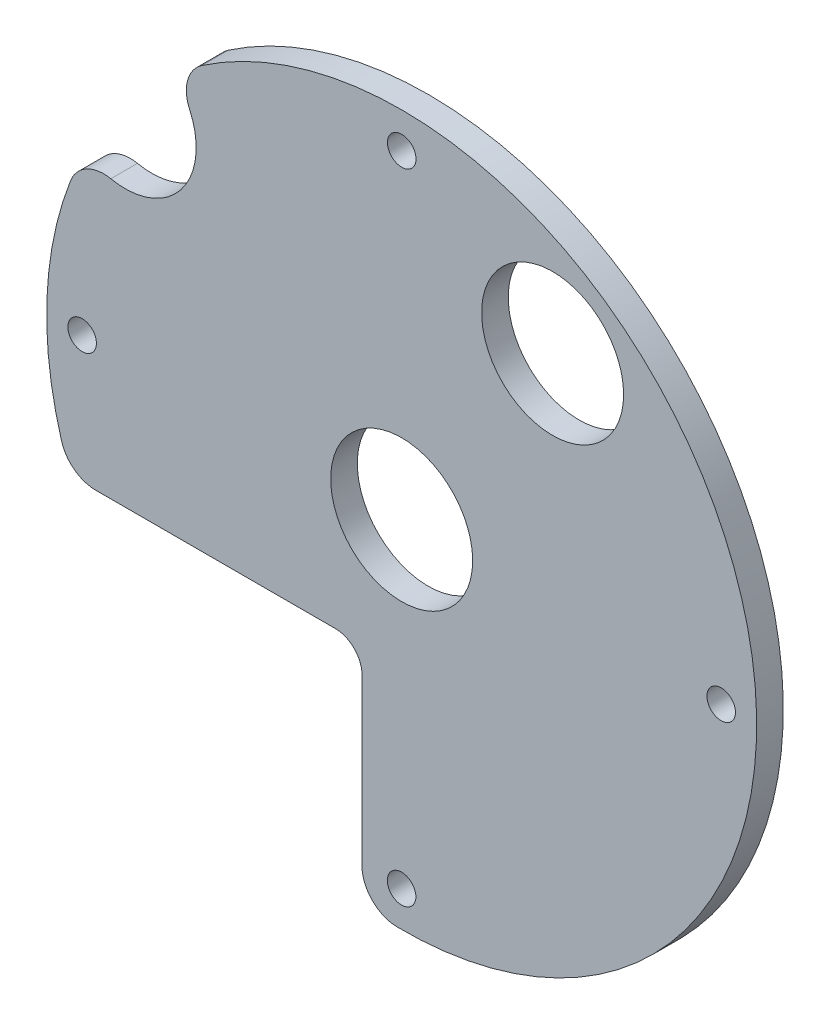
from build123d import *

# Parameters (mm, degrees)
SKETCH2_W                  = 228.6
SKETCH2_H                  = 165.1
BOSS_EXTRUDE1_DEPTH        = 4.7625
F_1_2_0_5_DIAMETER_HOLE1_D = 25.4
SKETCH7_R                  = 66.675
CUT_EXTRUDE4_DEPTH         = 169.123203057
FILLET1_R                  = 6.35
CUT_EXTRUDE5_DEPTH         = 169.123203057
FILLET2_R                  = 4.7625
SKETCH9_R                  = 2.5527
CUT_EXTRUDE6_DEPTH         = 169.123203057
SKETCH10_OUTSIDE_W         = 285.248
SKETCH10_OUTSIDE_H         = 206.251
SKETCH10_OUTSIDE_R         = 63.5
CUT_EXTRUDE7_DEPTH         = 169.123203057
FILLET3_R                  = 6.35
SKETCH11_R                 = 2.5527
CUT_EXTRUDE8_DEPTH         = 133.640575761
CIRPATTERN1_COUNT          = 4


with BuildPart() as part:
    # Sketch2 → Boss-Extrude1 (new body)
    with BuildSketch(Plane.XY):
        with Locations((0, 40.65)):
            Rectangle(SKETCH2_W, SKETCH2_H)
    extrude(amount=BOSS_EXTRUDE1_DEPTH)

    # 1/2 (0.5) Diameter Hole1 (through all)
    with Locations(Plane.XY.offset(4.7625)):
        with Locations((-38.227, 85.227), (38.227, 85.227), (11.2268, 45.984)):
            Hole(F_1_2_0_5_DIAMETER_HOLE1_D / 2)

    # Sketch7 → Cut-Extrude4 (cut, through all)
    with BuildSketch(Plane(origin=(0, 0, 0), x_dir=(-1, 0, 0), z_dir=(0, 0, -1))):
        with Locations((0, 180.35)):
            Circle(SKETCH7_R)
    extrude(amount=-CUT_EXTRUDE4_DEPTH, mode=Mode.SUBTRACT)

    # Fillet1
    fillet1_edges = [part.edges().sort_by_distance(p)[0] for p in [
        (-114.3, -41.9, 2.38125),
        (114.3, -41.9, 2.38125),
        (114.3, 123.2, 2.38125),
        (-114.3, 123.2, 2.38125),
    ]]
    fillet(fillet1_edges, radius=FILLET1_R)

    # Sketch8 → Cut-Extrude5 (cut, through all)
    with BuildSketch(Plane.XY.offset(4.7625)):
        with BuildLine():
            Line((-107.95, -41.9), (107.95, -41.9))
            ThreePointArc((107.95, -41.9), (112.440128061, -40.040128061), (114.3, -35.55))
            Line((114.3, -35.55), (114.3, -10.15))
            Line((114.3, -10.15), (56.945117879, -10.15))
            ThreePointArc((56.945117879, -10.15), (32.110421547, -23.329546563), (4.1275, -26.053274001))
            Line((4.1275, -26.053274001), (4.1275, 23.1875))
            Line((4.1275, 23.1875), (-53.975, 23.1875))
            Line((-53.975, 23.1875), (-53.975, -10.15))
            Line((-53.975, -10.15), (-114.3, -10.15))
            Line((-114.3, -10.15), (-114.3, -35.55))
            ThreePointArc((-114.3, -35.55), (-112.440128061, -40.040128061), (-107.95, -41.9))
        make_face()
    extrude(amount=-CUT_EXTRUDE5_DEPTH, mode=Mode.SUBTRACT)

    # Fillet2
    fillet2_edges = [part.edges().sort_by_distance(p)[0] for p in [
        (114.3, -10.15, 2.38125),
        (56.945117879, -10.15, 2.38125),
        (4.1275, -26.053274001, 2.38125),
        (4.1275, 23.1875, 2.38125),
        (-53.975, 23.1875, 2.38125),
        (-53.975, -10.15, 2.38125),
        (-114.3, -10.15, 2.38125),
    ]]
    fillet(fillet2_edges, radius=FILLET2_R)

    # Sketch9 → Cut-Extrude6 (cut, through all)
    with BuildSketch(Plane.XY.offset(4.7625)):
        with Locations((-107.95, 116.85)):
            Circle(SKETCH9_R)
        with Locations((-109.5375, -5.3875)):
            Circle(SKETCH9_R)
        with Locations((109.5375, -5.3875)):
            Circle(SKETCH9_R)
        with Locations((107.95, 116.85)):
            Circle(SKETCH9_R)
    extrude(amount=-CUT_EXTRUDE6_DEPTH, mode=Mode.SUBTRACT)

    # Sketch10 outside → Cut-Extrude7 (cut, through all)
    with BuildSketch(Plane.XY.offset(4.7625)):
        with Locations((0, 48.3985)):
            Rectangle(SKETCH10_OUTSIDE_W, SKETCH10_OUTSIDE_H)
        with Locations((11.2268, 45.984)):
            Circle(SKETCH10_OUTSIDE_R, mode=Mode.SUBTRACT)
    extrude(amount=-CUT_EXTRUDE7_DEPTH, mode=Mode.SUBTRACT)

    # Fillet3
    fillet3_edges = [part.edges().sort_by_distance(p)[0] for p in [
        (4.1275, -17.117901235, 2.38125),
        (-29.641139389, 94.585044537, 2.38125),
        (-45.389292566, 74.73931364, 2.38125),
        (-48.040135029, 23.1875, 2.38125),
    ]]
    fillet(fillet3_edges, radius=FILLET3_R)

    # Sketch11 → Cut-Extrude8 (cut, through all)
    with BuildSketch(Plane.XY.offset(4.7625)):
        with Locations((11.2395, 103.136517476)):
            Circle(SKETCH11_R)
    cut_extrude8 = extrude(amount=-CUT_EXTRUDE8_DEPTH, mode=Mode.SUBTRACT)

    # CirPattern1: Cut-Extrude8 ×4 about axis
    cirpattern1_axis = Axis((11.2268, 45.984, 4.7625), (0, 0, 1))
    for i in range(1, CIRPATTERN1_COUNT):
        add(cut_extrude8.rotate(cirpattern1_axis, i * 360 / CIRPATTERN1_COUNT), mode=Mode.SUBTRACT)


solid = part.part
